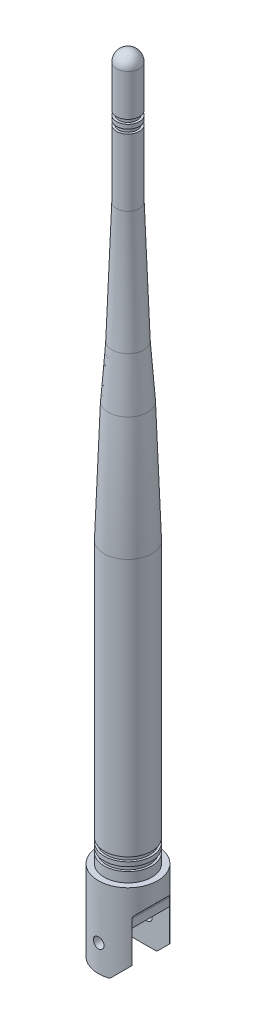
from build123d import *

# Parameters (mm, degrees)
SKETCH3_R               = 7
BOSS_EXTRUDE1_DEPTH     = 19
CUT_EXTRUDE1_DEPTH      = 9
CUT_EXTRUDE1_DEPTH_BACK = 4.46
SKETCH4_W               = 8.92
SKETCH4_H               = 10.7
CUT_EXTRUDE2_DEPTH      = 14.46
CUT_EXTRUDE2_DEPTH_BACK = 14.46
SKETCH5_R               = 1.25
FILLET1_R               = 1


with BuildPart() as part:
    # Sketch1 → Revolve1 (revolve)
    with BuildSketch(Plane.XY, mode=Mode.PRIVATE) as revolve1_sk:
        with BuildLine():
            Line((0, 0), (-5.6, 0))
            Line((-5.6, 0), (-5.6, 2.32))
            Line((-5.6, 2.32), (-5.095, 2.32))
            Line((-5.095, 2.32), (-5.095, 3.32))
            Line((-5.095, 3.32), (-5.6, 3.32))
            Line((-5.6, 3.32), (-5.6, 4.32))
            Line((-5.6, 4.32), (-5.095, 4.32))
            Line((-5.095, 4.32), (-5.095, 5.32))
            Line((-5.095, 5.32), (-5.6, 5.32))
            Line((-5.6, 5.32), (-5.6, 66.104936914))
            ThreePointArc((-5.6, 66.104936914), (-5.347653972, 80.311032213), (-4.590934282, 94.499203254))
            Line((-4.590934282, 94.499203254), (-3.714065718, 106.820796746))
            ThreePointArc((-3.714065718, 106.820796746), (-2.957346028, 121.008967787), (-2.705, 135.215063086))
            Line((-2.705, 135.215063086), (-2.705, 151))
            Line((-2.705, 151), (-2.17, 151))
            Line((-2.17, 151), (-2.17, 152))
            Line((-2.17, 152), (-2.705, 152))
            Line((-2.705, 152), (-2.705, 153))
            Line((-2.705, 153), (-2.17, 153))
            Line((-2.17, 153), (-2.17, 154))
            Line((-2.17, 154), (-2.705, 154))
            Line((-2.705, 154), (-2.705, 163.795))
            ThreePointArc((-2.705, 163.795), (-1.912723843, 165.707723843), (0, 166.5))
            Line((0, 166.5), (0, 0))
        make_face()
    revolve(revolve1_sk.sketch.rotate(Axis((0, 0, 0), (0, 1, 0)), 270), axis=Axis((0, 0, 0), (0, 1, 0)))

    # Sketch3 → Boss-Extrude1 (add)
    with BuildSketch(Plane.XZ):
        with Locations(Location((0, 0, 0), (0, 0, 270))):
            Circle(SKETCH3_R)
    extrude(amount=BOSS_EXTRUDE1_DEPTH)

    # Sketch4 → Cut-Extrude1 (cut, two sides: drawn at the far end of the back side and taken through both)
    with BuildSketch(Plane(origin=(0, 0, 0), x_dir=(0, 0, -1), z_dir=(1, 0, 0)).offset(-CUT_EXTRUDE1_DEPTH_BACK)):
        with Locations((0, -13.65)):
            Rectangle(SKETCH4_W, SKETCH4_H)
    extrude(amount=CUT_EXTRUDE1_DEPTH + CUT_EXTRUDE1_DEPTH_BACK, mode=Mode.SUBTRACT)

    # Sketch5 → Cut-Extrude2 (cut, two sides: drawn at the far end of the back side and taken through both)
    with BuildSketch(Plane.XY.offset(-CUT_EXTRUDE2_DEPTH_BACK)):
        with Locations(Location((0, -12.7, 0), (0, 0, 180))):
            Circle(SKETCH5_R)
        Polygon((5.395220107, -6), (5.395220107, -15.933988373), (0.784672068, -20.544536411), (9.016530708, -20.544536411), (9.016530708, -2.378689399), align=None)
    extrude(amount=CUT_EXTRUDE2_DEPTH + CUT_EXTRUDE2_DEPTH_BACK, mode=Mode.SUBTRACT)

    # Fillet1
    fillet1_edges = [part.edges().sort_by_distance(p)[0] for p in [
        (5.395220107, -6, 0),
        (2.329208479, -19, -5.530560099),
        (2.329208479, -19, 5.530560099),
        (-4.46, -13.65, -4.46),
        (-4.46, -13.65, 4.46),
    ]]
    fillet(fillet1_edges, radius=FILLET1_R)


solid = part.part
